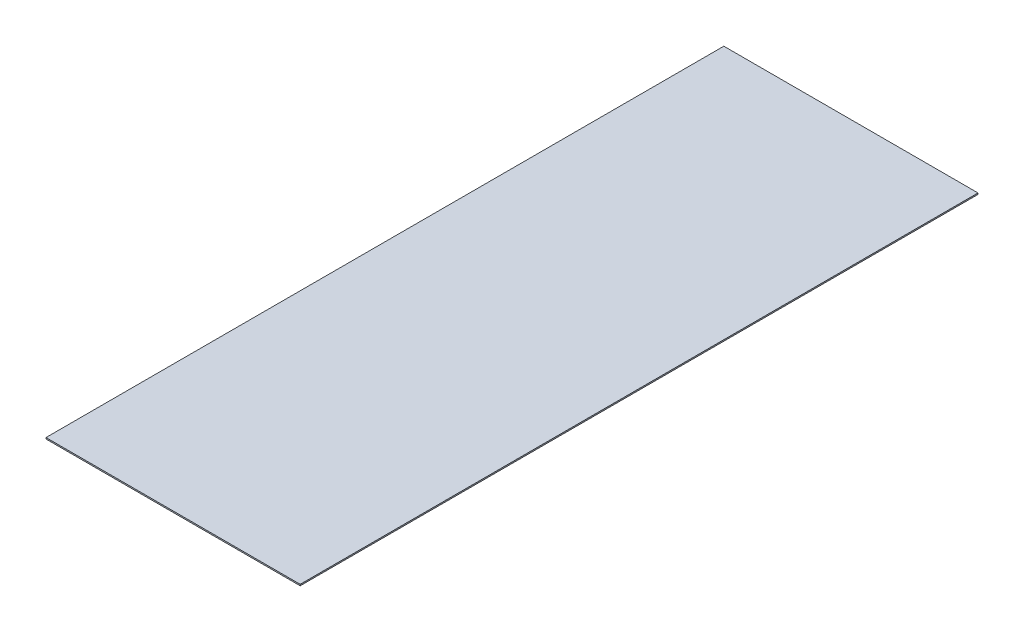
from build123d import *

# Parameters (mm, degrees)
CROQUIS1_W              = 914.4
CROQUIS1_H              = 2438.4
SALIENTE_EXTRUIR1_DEPTH = 4.8


with BuildPart() as part:
    # Croquis1 → Saliente-Extruir1 (new body)
    with BuildSketch(Plane(origin=(0, 0, 0), x_dir=(1, 0, 0), z_dir=(0, 1, 0))):
        Rectangle(CROQUIS1_W, CROQUIS1_H)
    extrude(amount=SALIENTE_EXTRUIR1_DEPTH)


solid = part.part
